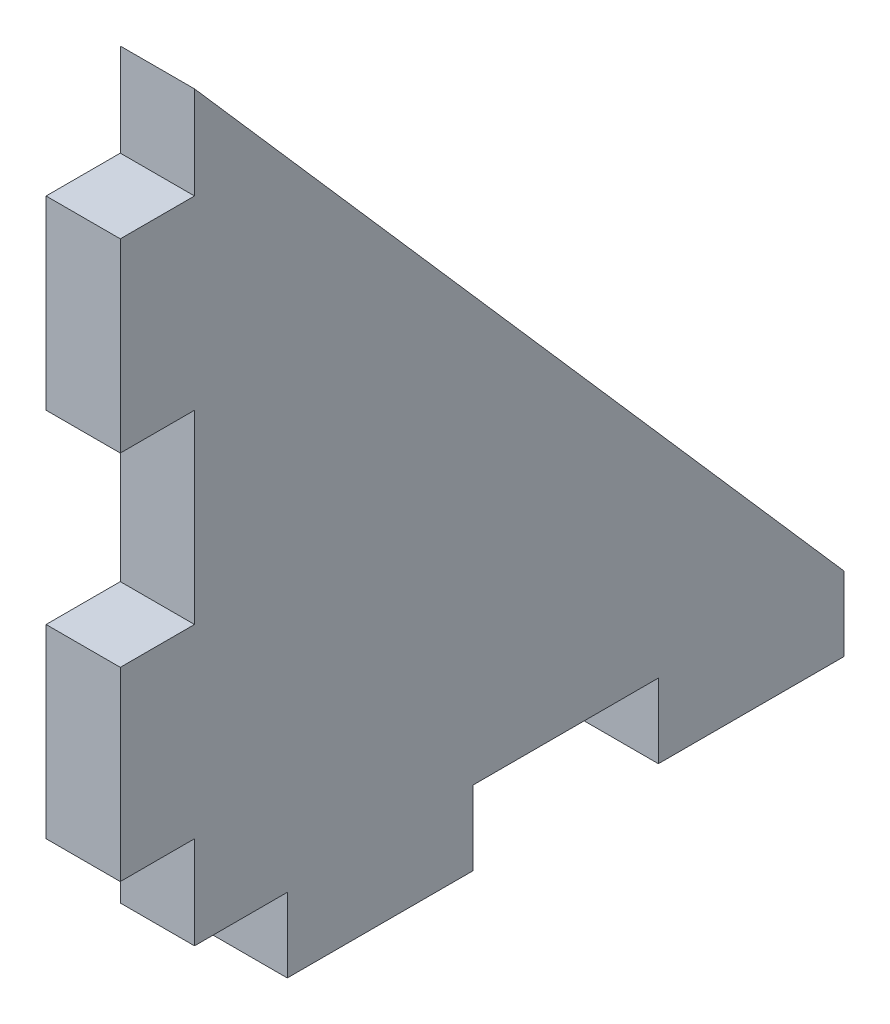
from build123d import *

# Parameters (mm, degrees)
BOSS_EXTRUDE1_DEPTH = 2


with BuildPart() as part:
    # Sketch1 → Boss-Extrude1 (new, symmetric)
    with BuildSketch(Plane(origin=(0, 0, 0), x_dir=(0, 0, -1), z_dir=(1, 0, 0))):
        Polygon((0, 0), (0, 5), (-4, 5), (-4, 15), (0, 15), (0, 25), (-4, 25), (-4, 35), (0, 35), (0, 40), (35, 0), (35, -4), (25, -4), (25, 0), (15, 0), (15, -4), (5, -4), (5, 0), align=None)
    extrude(amount=BOSS_EXTRUDE1_DEPTH, both=True)


solid = part.part
